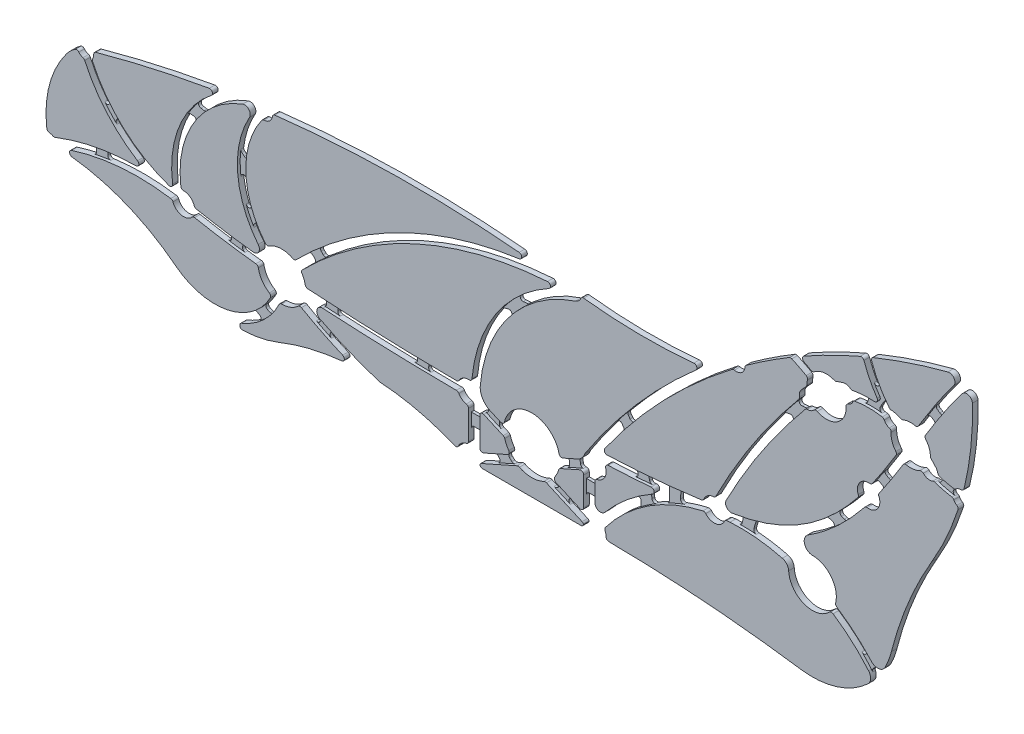
from build123d import *

# Parameters (mm, degrees)
EXTRUDE_1_DEPTH    = 2
EXTRUDE_1_2_DEPTH  = 2
EXTRUDE_1_3_DEPTH  = 2
EXTRUDE_1_4_DEPTH  = 2
EXTRUDE_1_5_DEPTH  = 2
EXTRUDE_1_6_DEPTH  = 2
EXTRUDE_1_7_DEPTH  = 2
EXTRUDE_1_8_DEPTH  = 2
EXTRUDE_1_9_DEPTH  = 2
EXTRUDE_1_10_DEPTH = 2
EXTRUDE_1_11_DEPTH = 2
EXTRUDE_1_12_DEPTH = 2
EXTRUDE_1_13_DEPTH = 2
EXTRUDE_1_14_DEPTH = 2
EXTRUDE_1_15_DEPTH = 2
EXTRUDE_1_16_DEPTH = 2
EXTRUDE_1_17_DEPTH = 2
EXTRUDE_1_18_DEPTH = 2
EXTRUDE_1_19_DEPTH = 2
EXTRUDE_1_20_DEPTH = 2
EXTRUDE_2_DEPTH    = 1


with BuildPart() as part:
    # ｽｹｯﾁ1 → ﾎﾞｽ - 押し出し1 (new body)
    with BuildSketch(Plane.XY):
        with BuildLine():
            Line((-22.5, -10.101020514), (-22.5, 0.101020514))
            ThreePointArc((-22.5, 0.101020514), (-22.725403331, 0.733476046), (-23.3, 1.080816412))
            ThreePointArc((-23.3, 1.080816412), (-24.842007836, 1.757316035), (-25.968976767, 3.008467879))
            ThreePointArc((-25.968976767, 3.008467879), (-26.333052589, 3.374773249), (-26.831338926, 3.510572931))
            ThreePointArc((-26.831338926, 3.510572931), (-50.650061214, 3.946700568), (-74.448487112, 5.022183474))
            ThreePointArc((-74.448487112, 5.022183474), (-76.493832753, 3.556551996), (-75.487010068, 1.250511558))
            ThreePointArc((-75.487010068, 1.250511558), (-65.082931287, -3.594550625), (-54.301384043, -7.528724215))
            ThreePointArc((-54.301384043, -7.528724215), (-54.184018837, -7.558239038), (-54.063947757, -7.573360277))
            ThreePointArc((-54.063947757, -7.573360277), (-40.48832194, -9.598088167), (-27.436621612, -13.846647678))
            ThreePointArc((-27.436621612, -13.846647678), (-26.685177052, -13.856277421), (-26.139219533, -13.339855069))
            ThreePointArc((-26.139219533, -13.339855069), (-24.990478153, -11.869901188), (-23.3, -11.080816412))
            ThreePointArc((-23.3, -11.080816412), (-22.725403331, -10.733476046), (-22.5, -10.101020514))
        make_face()
    extrude(amount=-EXTRUDE_1_DEPTH)



with BuildPart() as body_2:
    # ｽｹｯﾁ1 → Extrude 1 2 (new body)
    with BuildSketch(Plane.XY):
        with BuildLine():
            Line((22.5, 0.101020514), (22.5, -6.412581397))
            ThreePointArc((22.5, -6.412581397), (23.81401004, -8.291255869), (26.029417775, -7.701333223))
            ThreePointArc((26.029417775, -7.701333223), (33.93186129, 0.147888894), (43.093796505, 6.481753786))
            ThreePointArc((43.093796505, 6.481753786), (43.555392432, 7.64713656), (42.516080074, 8.347863062))
            ThreePointArc((42.516080074, 8.347863062), (34.893320679, 7.7891821), (27.260130447, 7.398040053))
            ThreePointArc((27.260130447, 7.398040053), (26.488503415, 6.982739341), (26.340268538, 6.119078888))
            ThreePointArc((26.340268538, 6.119078888), (25.924769368, 2.933371156), (23.3, 1.080816412))
            ThreePointArc((23.3, 1.080816412), (22.725403331, 0.733476046), (22.5, 0.101020514))
        make_face()
    extrude(amount=-EXTRUDE_1_2_DEPTH)


with BuildPart() as body_3:
    # ｽｹｯﾁ1 → Extrude 1 3 (new body)
    with BuildSketch(Plane.XY):
        with BuildLine():
            Line((18.5, -10.041983944), (18.5, 0.041983944))
            ThreePointArc((18.5, 0.041983944), (18.044913541, 0.880476182), (17.093861534, 0.955795493))
            Line((17.093861534, 0.955795493), (10.166331831, -2.123106598))
            ThreePointArc((10.166331831, -2.123106598), (9.818127838, -2.380437031), (9.611336633, -2.760834679))
            ThreePointArc((9.611336633, -2.760834679), (9.032200451, -4.291777604), (8.211074914, -5.70773587))
            ThreePointArc((8.211074914, -5.70773587), (8.06909808, -6.547709353), (8.626043939, -7.192321006))
            Line((8.626043939, -7.192321006), (17.093861534, -10.955795493))
            ThreePointArc((17.093861534, -10.955795493), (18.044913541, -10.880476182), (18.5, -10.041983944))
        make_face()
    extrude(amount=-EXTRUDE_1_3_DEPTH)


with BuildPart() as body_4:
    # ｽｹｯﾁ1 → Extrude 1 4 (new body)
    with BuildSketch(Plane.XY):
        with BuildLine():
            Line((-10.166331831, -2.123106598), (-17.093861534, 0.955795493))
            ThreePointArc((-17.093861534, 0.955795493), (-18.044913541, 0.880476182), (-18.5, 0.041983944))
            Line((-18.5, 0.041983944), (-18.5, -10.041983944))
            ThreePointArc((-18.5, -10.041983944), (-18.044913541, -10.880476182), (-17.093861534, -10.955795493))
            Line((-17.093861534, -10.955795493), (-8.626043939, -7.192321006))
            ThreePointArc((-8.626043939, -7.192321006), (-8.06909808, -6.547709353), (-8.211074914, -5.70773587))
            ThreePointArc((-8.211074914, -5.70773587), (-9.032200451, -4.291777604), (-9.611336633, -2.760834679))
            ThreePointArc((-9.611336633, -2.760834679), (-9.818127838, -2.380437031), (-10.166331831, -2.123106598))
        make_face()
    extrude(amount=-EXTRUDE_1_4_DEPTH)


with BuildPart() as body_5:
    # ｽｹｯﾁ1 → Extrude 1 5 (new body)
    with BuildSketch(Plane.XY):
        with BuildLine():
            Line((-17.5, -16), (17.5, -16))
            ThreePointArc((17.5, -16), (18.127636647, -15.778506416), (18.477238313, -15.212144479))
            ThreePointArc((18.477238313, -15.212144479), (18.268989106, -14.854674582), (17.933872224, -14.612086178))
            Line((17.933872224, -14.612086178), (5.236576226, -8.968843512))
            ThreePointArc((5.236576226, -8.968843512), (4.812235497, -8.882820735), (4.391307055, -8.984231873))
            ThreePointArc((4.391307055, -8.984231873), (0, -10), (-4.391307055, -8.984231873))
            ThreePointArc((-4.391307055, -8.984231873), (-4.812235497, -8.882820735), (-5.236576226, -8.968843512))
            Line((-5.236576226, -8.968843512), (-17.933872224, -14.612086178))
            ThreePointArc((-17.933872224, -14.612086178), (-18.268989106, -14.854674582), (-18.477238313, -15.212144479))
            ThreePointArc((-18.477238313, -15.212144479), (-18.127636647, -15.778506416), (-17.5, -16))
        make_face()
    extrude(amount=-EXTRUDE_1_5_DEPTH)


with BuildPart() as body_6:
    # ｽｹｯﾁ1 → Extrude 1 6 (new body)
    with BuildSketch(Plane.XY):
        with BuildLine():
            Line((11.118968747, 1.583240188), (16.202361285, 3.84252576))
            ThreePointArc((16.202361285, 3.84252576), (17.758858971, 4.928471706), (18.798519535, 6.516259335))
            ThreePointArc((18.798519535, 6.516259335), (18.959270279, 6.860976368), (19.152035998, 7.188866612))
            ThreePointArc((19.152035998, 7.188866612), (37.276714505, 31.160374537), (58.499178516, 52.438160712))
            ThreePointArc((58.499178516, 52.438160712), (58.759792741, 53.585885084), (57.747756386, 54.186695724))
            ThreePointArc((57.747756386, 54.186695724), (38.112812762, 53.374184357), (18.499758812, 54.606783477))
            ThreePointArc((18.499758812, 54.606783477), (17.871800431, 54.471525722), (17.45567904, 53.982169639))
            ThreePointArc((17.45567904, 53.982169639), (16.726416816, 52.906959729), (15.610951372, 52.240899233))
            ThreePointArc((15.610951372, 52.240899233), (-7.814521193, 35.812462193), (-18.322470408, 9.199884119))
            ThreePointArc((-18.322470408, 9.199884119), (-17.508416253, 5.639452419), (-14.780704116, 3.210678129))
            Line((-14.780704116, 3.210678129), (-11.118968747, 1.583240188))
            ThreePointArc((-11.118968747, 1.583240188), (-10.267282975, 1.601793339), (-9.738936619, 2.270047033))
            ThreePointArc((-9.738936619, 2.270047033), (0, 10), (9.738936619, 2.270047033))
            ThreePointArc((9.738936619, 2.270047033), (10.267282975, 1.601793339), (11.118968747, 1.583240188))
        make_face()
    extrude(amount=-EXTRUDE_1_6_DEPTH)


with BuildPart() as body_7:
    # ｽｹｯﾁ1 → Extrude 1 7 (new body)
    with BuildSketch(Plane.XY):
        with BuildLine():
            ThreePointArc((-103.356558634, -14.060718986), (-95.498956322, -9.057744291), (-89.967031901, -1.563114074))
            ThreePointArc((-89.967031901, -1.563114074), (-89.595121172, -1.150343934), (-89.060304278, -0.999786079))
            ThreePointArc((-89.060304278, -0.999786079), (-85.918070339, -0.421597665), (-83.211270872, 1.275804061))
            ThreePointArc((-83.211270872, 1.275804061), (-82.64364503, 1.537095003), (-82.031739222, 1.410432715))
            ThreePointArc((-82.031739222, 1.410432715), (-74.799057097, -2.464433401), (-67.34675765, -5.898019149))
            ThreePointArc((-67.34675765, -5.898019149), (-66.749100435, -6.968649503), (-67.637822736, -7.813407558))
            ThreePointArc((-67.637822736, -7.813407558), (-79.072499433, -9.782229594), (-90.117629525, -13.336549869))
            ThreePointArc((-90.117629525, -13.336549869), (-96.419112305, -15.235486438), (-102.957342201, -15.987945839))
            ThreePointArc((-102.957342201, -15.987945839), (-103.962078134, -15.191111022), (-103.356558634, -14.060718986))
        make_face()
    extrude(amount=-EXTRUDE_1_7_DEPTH)


with BuildPart() as body_8:
    # ｽｹｯﾁ1 → Extrude 1 8 (new body)
    with BuildSketch(Plane.XY):
        with BuildLine():
            ThreePointArc((-126.720890547, -8.125345919), (-144.171431804, 2.021447824), (-163.725732783, 7.032248826))
            ThreePointArc((-163.725732783, 7.032248826), (-164.608066794, 7.92635712), (-163.920291551, 8.977503239))
            ThreePointArc((-163.920291551, 8.977503239), (-146.403950854, 12.457005785), (-128.557163274, 11.807927609))
            ThreePointArc((-128.557163274, 11.807927609), (-128.07237572, 11.59059704), (-127.76731798, 11.155635749))
            ThreePointArc((-127.76731798, 11.155635749), (-124.75804267, 8.572485352), (-121.003592282, 9.850180989))
            ThreePointArc((-121.003592282, 9.850180989), (-120.575847385, 10.134684344), (-120.063293842, 10.169278015))
            ThreePointArc((-120.063293842, 10.169278015), (-109.189695688, 8.283956274), (-98.247377431, 6.850343342))
            ThreePointArc((-98.247377431, 6.850343342), (-97.672725088, 6.585818326), (-97.371810397, 6.029357053))
            ThreePointArc((-97.371810397, 6.029357053), (-96.028031748, 2.719124583), (-93.442710672, 0.253461386))
            ThreePointArc((-93.442710672, 0.253461386), (-93.00002742, -0.338132848), (-93.084381906, -1.072187697))
            ThreePointArc((-93.084381906, -1.072187697), (-108.261136719, -12.427077278), (-126.720890547, -8.125345919))
        make_face()
    extrude(amount=-EXTRUDE_1_8_DEPTH)


with BuildPart() as body_9:
    # ｽｹｯﾁ1 → Extrude 1 9 (new body)
    with BuildSketch(Plane.XY):
        with BuildLine():
            ThreePointArc((-114.850046871, 52.666941105), (-135.171119836, 48.606684839), (-155.268554706, 43.554477497))
            ThreePointArc((-155.268554706, 43.554477497), (-155.803951642, 43.187014896), (-156.000775173, 42.568194129))
            ThreePointArc((-156.000775173, 42.568194129), (-156.085215089, 41.790050054), (-156.368067103, 41.060232927))
            ThreePointArc((-156.368067103, 41.060232927), (-156.490114246, 40.616134725), (-156.400178828, 40.164437549))
            ThreePointArc((-156.400178828, 40.164437549), (-145.340870587, 25.04107642), (-129.217245632, 15.498903244))
            ThreePointArc((-129.217245632, 15.498903244), (-128.25649785, 15.67177038), (-127.900790598, 16.580831267))
            ThreePointArc((-127.900790598, 16.580831267), (-125.547381919, 35.580716416), (-114.059534107, 50.896183133))
            ThreePointArc((-114.059534107, 50.896183133), (-113.765093768, 52.089460809), (-114.850046871, 52.666941105))
        make_face()
    extrude(amount=-EXTRUDE_1_9_DEPTH)


with BuildPart() as body_10:
    # ｽｹｯﾁ1 → Extrude 1 10 (new body)
    with BuildSketch(Plane.XY):
        with BuildLine():
            ThreePointArc((-140.92626069, 15.699704338), (-155.581300438, 14.221758305), (-169.717010958, 10.08216864))
            ThreePointArc((-169.717010958, 10.08216864), (-170.14622041, 10.013780427), (-170.563904339, 10.133937974))
            ThreePointArc((-170.563904339, 10.133937974), (-171.155696028, 10.378741184), (-171.785964151, 10.492355035))
            ThreePointArc((-171.785964151, 10.492355035), (-172.401803697, 10.763324084), (-172.706566648, 11.363159157))
            ThreePointArc((-172.706566648, 11.363159157), (-171.77520359, 25.346722117), (-165.635293674, 37.944697209))
            ThreePointArc((-165.635293674, 37.944697209), (-164.259804057, 39.486741818), (-162.652608619, 40.785508959))
            ThreePointArc((-162.652608619, 40.785508959), (-161.947741849, 40.949117243), (-161.317043281, 40.594400243))
            ThreePointArc((-161.317043281, 40.594400243), (-160.648344956, 39.993416886), (-159.831599898, 39.617563251))
            ThreePointArc((-159.831599898, 39.617563251), (-159.454634512, 39.413102568), (-159.197974761, 39.069543482))
            ThreePointArc((-159.197974761, 39.069543482), (-151.384643178, 26.924630489), (-140.402865662, 17.546591002))
            ThreePointArc((-140.402865662, 17.546591002), (-139.972472291, 16.427013854), (-140.92626069, 15.699704338))
        make_face()
    extrude(amount=-EXTRUDE_1_10_DEPTH)


with BuildPart() as body_11:
    # ｽｹｯﾁ1 → Extrude 1 11 (new body)
    with BuildSketch(Plane.XY):
        with BuildLine():
            ThreePointArc((-4.470999079, 57.250282757), (-48.007817114, 58.908356302), (-91.48378022, 56.07209741))
            ThreePointArc((-91.48378022, 56.07209741), (-92.069225942, 55.791149679), (-92.358682449, 55.209863819))
            ThreePointArc((-92.358682449, 55.209863819), (-93.350087626, 53.351369569), (-95.318967313, 52.602772294))
            ThreePointArc((-95.318967313, 52.602772294), (-95.774491653, 52.49062391), (-96.128746209, 52.183079777))
            ThreePointArc((-96.128746209, 52.183079777), (-101.822459182, 33.316779439), (-94.900870104, 14.865566457))
            ThreePointArc((-94.900870104, 14.865566457), (-94.283684874, 14.510594718), (-93.586754605, 14.6562338))
            ThreePointArc((-93.586754605, 14.6562338), (-89.394333262, 15.990848089), (-85.096260122, 15.05055064))
            ThreePointArc((-85.096260122, 15.05055064), (-84.479111763, 14.951393184), (-83.923649691, 15.238039629))
            ThreePointArc((-83.923649691, 15.238039629), (-47.483352354, 41.826061968), (-4.422429146, 55.263885244))
            ThreePointArc((-4.422429146, 55.263885244), (-3.560849299, 56.278744516), (-4.470999079, 57.250282757))
        make_face()
    extrude(amount=-EXTRUDE_1_11_DEPTH)


with BuildPart() as body_12:
    # ｽｹｯﾁ1 → Extrude 1 12 (new body)
    with BuildSketch(Plane.XY):
        with BuildLine():
            ThreePointArc((-22.314015361, 8.995673875), (-24.414609558, 8.512017973), (-25.959198864, 7.008467879))
            ThreePointArc((-25.959198864, 7.008467879), (-26.327181142, 6.642729772), (-26.828894412, 6.510596833))
            ThreePointArc((-26.828894412, 6.510596833), (-53.301872163, 7.036667802), (-79.74722804, 8.355172349))
            ThreePointArc((-79.74722804, 8.355172349), (-80.341592557, 8.601026945), (-80.663274603, 9.158013769))
            ThreePointArc((-80.663274603, 9.158013769), (-81.101716083, 10.641195817), (-81.801654702, 12.020378853))
            ThreePointArc((-81.801654702, 12.020378853), (-81.94890883, 12.660487916), (-81.667277078, 13.253873919))
            ThreePointArc((-81.667277078, 13.253873919), (-41.702064453, 41.277821121), (5.609573539, 53.284850211))
            ThreePointArc((5.609573539, 53.284850211), (6.637189872, 52.564938691), (6.152522338, 51.407629179))
            ThreePointArc((6.152522338, 51.407629179), (-12.757832942, 34.089272661), (-21.271842987, 9.901700598))
            ThreePointArc((-21.271842987, 9.901700598), (-21.611427135, 9.239911484), (-22.314015361, 8.995673875))
        make_face()
    extrude(amount=-EXTRUDE_1_12_DEPTH)


with BuildPart() as body_13:
    # ｽｹｯﾁ1 → Extrude 1 13 (new body)
    with BuildSketch(Plane.XY):
        with BuildLine():
            ThreePointArc((-100.505114473, 50.878987248), (-104.726719606, 31.575944409), (-97.424637255, 13.215415929))
            ThreePointArc((-97.424637255, 13.215415929), (-97.235079465, 10.997428592), (-99.214022424, 9.978024479))
            ThreePointArc((-99.214022424, 9.978024479), (-109.36232121, 11.345501175), (-119.449838366, 13.106171051))
            ThreePointArc((-119.449838366, 13.106171051), (-119.918131969, 13.335906367), (-120.207034495, 13.770201826))
            ThreePointArc((-120.207034495, 13.770201826), (-121.659362935, 15.743673555), (-123.98999328, 16.499987483))
            ThreePointArc((-123.98999328, 16.499987483), (-124.649769443, 16.750726015), (-124.979615741, 17.374725869))
            ThreePointArc((-124.979615741, 17.374725869), (-120.295248245, 39.392547584), (-102.944576602, 53.73416414))
            ThreePointArc((-102.944576602, 53.73416414), (-100.727848949, 53.158409228), (-100.505114473, 50.878987248))
        make_face()
    extrude(amount=-EXTRUDE_1_13_DEPTH)


with BuildPart() as body_14:
    # ｽｹｯﾁ1 → Extrude 1 14 (new body)
    with BuildSketch(Plane.XY):
        with BuildLine():
            ThreePointArc((107.745169421, 73.920489866), (104.035554327, 74.414473762), (100.601598753, 72.926786512))
            ThreePointArc((100.601598753, 72.926786512), (100.053312977, 72.707932638), (99.477126101, 72.836474436))
            ThreePointArc((99.477126101, 72.836474436), (98.233931235, 73.530059693), (96.976789503, 74.198033231))
            ThreePointArc((96.976789503, 74.198033231), (96.437083464, 75.068877577), (96.946878275, 75.957562975))
            ThreePointArc((96.946878275, 75.957562975), (106.841656639, 81.189233057), (116.993029265, 85.9037473))
            ThreePointArc((116.993029265, 85.9037473), (117.791441284, 85.902420306), (118.334402634, 85.317051632))
            ThreePointArc((118.334402634, 85.317051632), (120.363163566, 80.53748433), (122.987570022, 76.057235981))
            ThreePointArc((122.987570022, 76.057235981), (123.025245698, 74.997944172), (122.089604161, 74.499854314))
            ThreePointArc((122.089604161, 74.499854314), (118.195023505, 74.518282292), (114.330580957, 74.03435888))
            ThreePointArc((114.330580957, 74.03435888), (113.911582503, 74.043529717), (113.533139444, 74.223598206))
            ThreePointArc((113.533139444, 74.223598206), (112.244264312, 74.796025008), (110.836246698, 74.71628826))
            ThreePointArc((110.836246698, 74.71628826), (109.660624664, 74.335336357), (108.50077585, 73.908766026))
            ThreePointArc((108.50077585, 73.908766026), (108.121822546, 73.840504228), (107.745169421, 73.920489866))
        make_face()
    extrude(amount=-EXTRUDE_1_14_DEPTH)


with BuildPart() as body_15:
    # ｽｹｯﾁ1 → Extrude 1 15 (new body)
    with BuildSketch(Plane.XY):
        with BuildLine():
            ThreePointArc((89.273595206, 9.756792154), (80.049706865, 11.400344352), (70.682393404, 11.586941397))
            ThreePointArc((70.682393404, 11.586941397), (70.643120282, 11.583872322), (70.603998507, 11.579258847))
            ThreePointArc((70.603998507, 11.579258847), (70.017526668, 11.500504899), (69.430506154, 11.425950762))
            ThreePointArc((69.430506154, 11.425950762), (68.960800584, 11.239294826), (68.642371358, 10.846781657))
            ThreePointArc((68.642371358, 10.846781657), (65.564057635, 8.539969825), (61.964082393, 9.895541461))
            ThreePointArc((61.964082393, 9.895541461), (61.519642672, 10.193671151), (60.985116277, 10.219929694))
            ThreePointArc((60.985116277, 10.219929694), (41.602155025, 2.06939678), (26.224992097, -12.271915363))
            ThreePointArc((26.224992097, -12.271915363), (26.029919562, -12.770267331), (26.119760126, -13.297843535))
            ThreePointArc((26.119760126, -13.297843535), (26.405864749, -14.137317809), (26.499953909, -15.019202234))
            ThreePointArc((26.499953909, -15.019202234), (26.787762201, -15.725999505), (27.49034138, -16.023956702))
            ThreePointArc((27.49034138, -16.023956702), (61.783072383, -17.486582136), (95.904497639, -21.209351445))
            ThreePointArc((95.904497639, -21.209351445), (108.674407076, -20.172272438), (119.751248422, -13.734127855))
            ThreePointArc((119.751248422, -13.734127855), (120.70255746, -11.718381768), (120.000805926, -9.602781154))
            ThreePointArc((120.000805926, -9.602781154), (114.070402793, -3.50960152), (107.337748418, 1.683459661))
            ThreePointArc((107.337748418, 1.683459661), (106.680167747, 1.84485003), (106.070500124, 1.550291751))
            ThreePointArc((106.070500124, 1.550291751), (97.009254914, -0.45647182), (91.513444146, 7.022119544))
            ThreePointArc((91.513444146, 7.022119544), (90.839066816, 8.754383733), (89.273595206, 9.756792154))
        make_face()
    extrude(amount=-EXTRUDE_1_15_DEPTH)


with BuildPart() as body_16:
    # ｽｹｯﾁ1 → Extrude 1 16 (new body)
    with BuildSketch(Plane.XY):
        with BuildLine():
            ThreePointArc((71.343129401, 59.077169187), (46.898048291, 37.235706645), (26.021967296, 11.961199356))
            ThreePointArc((26.021967296, 11.961199356), (25.960207207, 10.906984019), (26.878319095, 10.385203561))
            ThreePointArc((26.878319095, 10.385203561), (43.722386211, 11.463371837), (60.493566976, 13.364040033))
            ThreePointArc((60.493566976, 13.364040033), (60.972999003, 13.567125642), (61.285349547, 13.983702131))
            ThreePointArc((61.285349547, 13.983702131), (62.655797065, 15.741097437), (64.753909299, 16.492422744))
            ThreePointArc((64.753909299, 16.492422744), (65.240913382, 16.654395429), (65.583431059, 17.036612343))
            ThreePointArc((65.583431059, 17.036612343), (79.093035157, 40.212538503), (95.134397943, 61.713878839))
            ThreePointArc((95.134397943, 61.713878839), (95.336157636, 62.105899259), (95.349720401, 62.546583993))
            ThreePointArc((95.349720401, 62.546583993), (95.395423067, 63.8877696), (96.021295968, 65.074846127))
            ThreePointArc((96.021295968, 65.074846127), (96.845691965, 65.995488705), (97.705410986, 66.8832357))
            ThreePointArc((97.705410986, 66.8832357), (97.921285564, 67.202082756), (98.000680849, 67.578860765))
            ThreePointArc((98.000680849, 67.578860765), (98.063053837, 68.418663332), (98.225822663, 69.244898802))
            ThreePointArc((98.225822663, 69.244898802), (98.178932991, 69.886768371), (97.750631704, 70.36713614))
            ThreePointArc((97.750631704, 70.36713614), (95.226633677, 71.724656509), (92.646482628, 72.972153264))
            ThreePointArc((92.646482628, 72.972153264), (92.1751128, 73.061144555), (91.716533423, 72.920382631))
            ThreePointArc((91.716533423, 72.920382631), (83.925565639, 68.022389418), (76.349274765, 62.798470094))
            ThreePointArc((76.349274765, 62.798470094), (76.054051204, 62.462018089), (75.935182614, 62.030477638))
            ThreePointArc((75.935182614, 62.030477638), (74.72769572, 59.751974852), (72.197875937, 59.252363596))
            ThreePointArc((72.197875937, 59.252363596), (71.750387624, 59.262904595), (71.343129401, 59.077169187))
        make_face()
    extrude(amount=-EXTRUDE_1_16_DEPTH)


with BuildPart() as body_17:
    # ｽｹｯﾁ1 → Extrude 1 17 (new body)
    with BuildSketch(Plane.XY):
        with BuildLine():
            ThreePointArc((69.257723432, 17.617675978), (69.404595356, 15.529642509), (71.333254774, 14.716175865))
            add(Edge.make_bspline(
                [(71.333254774, 14.716175865), (71.614504166, 14.759136638), (73.409438449, 15.043486715), (76.620780353, 15.671863381), (80.797913885, 16.762501548), (86.082324681, 18.506149632), (92.181209568, 21.200378892), (98.790819511, 25.172870999), (104.787291443, 29.804254012), (110.605870721, 35.341540936), (114.252250774, 39.538319712), (116.153912199, 41.910100809)],
                knots=[0.541498181, 0.541498181, 0.541498181, 0.541498181, 0.547174934, 0.577902268, 0.608629602, 0.639356936, 0.700811604, 0.762266273, 0.823720941, 0.885175609, 0.958224109, 0.958224109, 0.958224109, 0.958224109], degree=3))
            ThreePointArc((116.153912199, 41.910100809), (116.363463713, 42.392765504), (116.298978924, 42.914990318))
            ThreePointArc((116.298978924, 42.914990318), (116.797403013, 46.828904068), (120.411783315, 48.411118481))
            ThreePointArc((120.411783315, 48.411118481), (120.929284322, 48.495781267), (121.332792985, 48.830678024))
            add(Edge.make_bspline(
                [(121.332792985, 48.830678024), (123.860286294, 52.425795928), (126.654423832, 56.750949776), (129.38878449, 61.166659042), (129.760514936, 61.769694758)],
                knots=[0.352317169, 0.352317169, 0.352317169, 0.352317169, 0.456353113, 0.472763953, 0.472763953, 0.472763953, 0.472763953], degree=3))
            ThreePointArc((129.760514936, 61.769694758), (129.906330096, 62.370863984), (129.67059794, 62.942787797))
            ThreePointArc((129.67059794, 62.942787797), (128.348605081, 65.299730994), (128.017920694, 67.981800007))
            ThreePointArc((128.017920694, 67.981800007), (127.852816871, 68.607581037), (127.339079784, 69.00119935))
            ThreePointArc((127.339079784, 69.00119935), (126.29654459, 69.60730952), (125.576906384, 70.574971663))
            ThreePointArc((125.576906384, 70.574971663), (125.281409422, 70.943694366), (124.849604668, 71.135578553))
            ThreePointArc((124.849604668, 71.135578553), (120, 71.572377608), (115.150395332, 71.135578553))
            ThreePointArc((115.150395332, 71.135578553), (114.718590578, 70.943694366), (114.423093616, 70.574971663))
            ThreePointArc((114.423093616, 70.574971663), (113.70345541, 69.60730952), (112.660920216, 69.00119935))
            ThreePointArc((112.660920216, 69.00119935), (112.147183129, 68.607581037), (111.982079306, 67.981800007))
            ThreePointArc((111.982079306, 67.981800007), (108.818181818, 61.614248932), (101.714859342, 61.299981825))
            ThreePointArc((101.714859342, 61.299981825), (101.075825626, 61.402437082), (100.50788434, 61.092108441))
            ThreePointArc((100.50788434, 61.092108441), (99.463987015, 60.354774164), (98.207911317, 60.118856168))
            ThreePointArc((98.207911317, 60.118856168), (97.769172649, 60.031474199), (97.41243615, 59.761536619))
            ThreePointArc((97.41243615, 59.761536619), (82.191064591, 39.453879405), (69.257723432, 17.617675978))
        make_face()
    extrude(amount=-EXTRUDE_1_17_DEPTH)


with BuildPart() as body_18:
    # ｽｹｯﾁ1 → Extrude 1 18 (new body)
    with BuildSketch(Plane.XY):
        with BuildLine():
            ThreePointArc((148.233146487, 96.700551949), (134.790692615, 92.706125691), (121.634308586, 87.851790875))
            ThreePointArc((121.634308586, 87.851790875), (121.100824658, 87.340386295), (121.064206489, 86.602281387))
            ThreePointArc((121.064206489, 86.602281387), (123.702181112, 80.633649045), (127.336357893, 75.213663689))
            ThreePointArc((127.336357893, 75.213663689), (127.703850215, 74.929373539), (128.160150137, 74.841841395))
            ThreePointArc((128.160150137, 74.841841395), (128.667281007, 74.821664241), (129.163753302, 74.71628826))
            ThreePointArc((129.163753302, 74.71628826), (130.339375336, 74.335336357), (131.49922415, 73.908766026))
            ThreePointArc((131.49922415, 73.908766026), (131.878177454, 73.840504228), (132.254830579, 73.920489866))
            ThreePointArc((132.254830579, 73.920489866), (134.392874909, 74.454853433), (136.591096214, 74.298006141))
            ThreePointArc((136.591096214, 74.298006141), (137.203180916, 74.348824921), (137.670112992, 74.747829517))
            add(Edge.make_bspline(
                [(137.670112992, 74.747829517), (140.240473974, 78.92571989), (144.300186764, 85.33672362), (148.708850772, 91.442758638), (150.326318977, 93.547208301)],
                knots=[0.06143114, 0.06143114, 0.06143114, 0.06143114, 0.174105437, 0.235583634, 0.235583634, 0.235583634, 0.235583634], degree=3))
            ThreePointArc((150.326318977, 93.547208301), (150.406889536, 95.872080726), (148.233146487, 96.700551949))
        make_face()
    extrude(amount=-EXTRUDE_1_18_DEPTH)


with BuildPart() as body_19:
    # ｽｹｯﾁ1 → Extrude 1 19 (new body)
    with BuildSketch(Plane.XY):
        with BuildLine():
            ThreePointArc((153.974336047, 63.496711978), (156.407303766, 77.356990536), (156.95871287, 91.41837744))
            ThreePointArc((156.95871287, 91.41837744), (155.584650657, 93.261989436), (153.38430558, 92.594581239))
            add(Edge.make_bspline(
                [(153.38430558, 92.594581239), (153.104495244, 92.236934413), (151.189593008, 89.761627373), (146.657650725, 83.453304938), (142.696287318, 77.192352385), (140.236781197, 73.194666812)],
                knots=[0.052703532, 0.052703532, 0.052703532, 0.052703532, 0.063492248, 0.126984497, 0.235410038, 0.235410038, 0.235410038, 0.235410038], degree=3))
            ThreePointArc((140.236781197, 73.194666812), (140.091472024, 72.593588521), (140.327435168, 72.021984408))
            ThreePointArc((140.327435168, 72.021984408), (141.551530732, 69.946479233), (141.999319151, 67.578860765))
            ThreePointArc((141.999319151, 67.578860765), (142.078714436, 67.202082756), (142.294589014, 66.8832357))
            ThreePointArc((142.294589014, 66.8832357), (143.154308035, 65.995488705), (143.978704032, 65.074846127))
            ThreePointArc((143.978704032, 65.074846127), (144.399069128, 64.437692205), (144.645024595, 63.715073466))
            ThreePointArc((144.645024595, 63.715073466), (144.882580356, 63.24428851), (145.326579343, 62.959795782))
            ThreePointArc((145.326579343, 62.959795782), (147.74564025, 62.291578487), (150.204030248, 61.786911622))
            ThreePointArc((150.204030248, 61.786911622), (150.638732608, 61.80885322), (151.022937008, 62.013388192))
            ThreePointArc((151.022937008, 62.013388192), (151.944301544, 62.552841011), (152.996239059, 62.735459239))
            ThreePointArc((152.996239059, 62.735459239), (153.617445554, 62.946282157), (153.974336047, 63.496711978))
        make_face()
    extrude(amount=-EXTRUDE_1_19_DEPTH)


with BuildPart() as body_20:
    # ｽｹｯﾁ1 → Extrude 1 20 (new body)
    with BuildSketch(Plane.XY):
        with BuildLine():
            ThreePointArc((143.571046826, 60.376062231), (146.562441547, 59.49371431), (149.612934356, 58.844504131))
            ThreePointArc((149.612934356, 58.844504131), (150.029216938, 58.669006172), (150.325785264, 58.328215988))
            ThreePointArc((150.325785264, 58.328215988), (150.789990268, 57.680099045), (151.40850633, 57.177128133))
            ThreePointArc((151.40850633, 57.177128133), (151.824628715, 56.66999307), (151.836934791, 56.014102551))
            ThreePointArc((151.836934791, 56.014102551), (147.745407286, 45.4518558), (142.536293001, 35.39368588))
            ThreePointArc((142.536293001, 35.39368588), (134.07925039, 18.380808166), (128.103750797, 0.346036683))
            ThreePointArc((128.103750797, 0.346036683), (127.166359581, -2.648345044), (125.910949972, -5.523926887))
            ThreePointArc((125.910949972, -5.523926887), (123.628983467, -7.150042408), (120.99938497, -6.182140264))
            ThreePointArc((120.99938497, -6.182140264), (115.180555638, -0.495167069), (108.676920035, 4.393919026))
            ThreePointArc((108.676920035, 4.393919026), (108.294327864, 4.864318046), (108.253865555, 5.469309624))
            ThreePointArc((108.253865555, 5.469309624), (106.702187254, 12.72787586), (100.0397327, 15.999907136))
            ThreePointArc((100.0397327, 15.999907136), (97.170625427, 18.170683147), (98.448115048, 21.534024536))
            add(Edge.make_bspline(
                [(118.549804324, 40.102350396), (116.038558432, 36.965392293), (111.587113707, 31.947718613), (104.759265589, 25.876093342), (100.538792211, 22.858680396), (98.448115048, 21.534024536)],
                knots=[0.54080668, 0.54080668, 0.54080668, 0.54080668, 0.634922483, 0.698414731, 0.755202759, 0.755202759, 0.755202759, 0.755202759], degree=3))
            ThreePointArc((118.549804324, 40.102350396), (118.958889754, 40.405801694), (119.464375375, 40.468394558))
            ThreePointArc((119.464375375, 40.468394558), (123.202688843, 42.03595994), (123.651791065, 46.064676361))
            ThreePointArc((123.651791065, 46.064676361), (123.569384023, 46.569027429), (123.746924759, 47.048235325))
            add(Edge.make_bspline(
                [(132.32709633, 60.216119374), (131.67046671, 59.15087034), (128.895331228, 54.684284987), (126.032249103, 50.295893269), (123.746924759, 47.048235325)],
                knots=[0.352132248, 0.352132248, 0.352132248, 0.352132248, 0.38095349, 0.473304271, 0.473304271, 0.473304271, 0.473304271], degree=3))
            ThreePointArc((132.32709633, 60.216119374), (132.7941666, 60.614639845), (133.406069368, 60.665119596))
            ThreePointArc((133.406069368, 60.665119596), (135.903222204, 60.539748523), (138.285140658, 61.299981825))
            ThreePointArc((138.285140658, 61.299981825), (138.924174374, 61.402437082), (139.49211566, 61.092108441))
            ThreePointArc((139.49211566, 61.092108441), (141.061105651, 60.187537156), (142.864802758, 60.35080242))
            ThreePointArc((142.864802758, 60.35080242), (143.215619048, 60.427899087), (143.571046826, 60.376062231))
        make_face()
    extrude(amount=-EXTRUDE_1_20_DEPTH)


with BuildPart() as part_1:
    add(part.part)

    add(body_2.part)  # ﾎﾞｽ - 押し出し2 merges body 2

    add(body_3.part)  # ﾎﾞｽ - 押し出し2 merges body 3

    add(body_4.part)  # ﾎﾞｽ - 押し出し2 merges body 4

    add(body_5.part)  # ﾎﾞｽ - 押し出し2 merges body 5

    add(body_6.part)  # ﾎﾞｽ - 押し出し2 merges body 6

    add(body_7.part)  # ﾎﾞｽ - 押し出し2 merges body 7

    add(body_8.part)  # ﾎﾞｽ - 押し出し2 merges body 8

    add(body_9.part)  # ﾎﾞｽ - 押し出し2 merges body 9

    add(body_10.part)  # ﾎﾞｽ - 押し出し2 merges body 10

    add(body_11.part)  # ﾎﾞｽ - 押し出し2 merges body 11

    add(body_12.part)  # ﾎﾞｽ - 押し出し2 merges body 12

    add(body_13.part)  # ﾎﾞｽ - 押し出し2 merges body 13

    add(body_14.part)  # ﾎﾞｽ - 押し出し2 merges body 14

    add(body_15.part)  # ﾎﾞｽ - 押し出し2 merges body 15

    add(body_16.part)  # ﾎﾞｽ - 押し出し2 merges body 16

    add(body_17.part)  # ﾎﾞｽ - 押し出し2 merges body 17

    add(body_18.part)  # ﾎﾞｽ - 押し出し2 merges body 18

    add(body_19.part)  # ﾎﾞｽ - 押し出し2 merges body 19

    add(body_20.part)  # ﾎﾞｽ - 押し出し2 merges body 20
    # ｽｹｯﾁ2 → ﾎﾞｽ - 押し出し2 (add)
    with BuildSketch(Plane(origin=(0, 0, -2), x_dir=(-1, 0, 0), z_dir=(0, 0, -1))):
        with BuildLine():
            Line((22.5, -1.5), (18.5, -1.5))
            Line((18.5, -1.5), (18.5, -6.5))
            ThreePointArc((18.5, -6.5), (18.792893219, -5.792893219), (19.5, -5.5))
            Line((19.5, -5.5), (21.5, -5.5))
            ThreePointArc((21.5, -5.5), (22.207106781, -5.792893219), (22.5, -6.5))
            Line((22.5, -6.5), (22.5, -1.5))
        make_face()
        with BuildLine():
            ThreePointArc((12.490856196, -0.478028756), (12.319505304, -1.000636204), (11.897726166, -1.353598004))
            Line((11.897726166, -1.353598004), (17.093861534, 0.955795493))
            ThreePointArc((17.093861534, 0.955795493), (17.263355075, 1.013580146), (17.440437139, 1.040208501))
            ThreePointArc((17.440437139, 1.040208501), (16.738781017, 1.271806523), (16.387681462, 1.921951168))
            ThreePointArc((16.387681462, 1.921951168), (16.235512399, 2.942471264), (16.019855375, 3.951485008))
            ThreePointArc((16.019855375, 3.951485008), (15.422642383, 3.543675476), (14.780704116, 3.210678129))
            Line((14.780704116, 3.210678129), (11.118968747, 1.583240188))
            ThreePointArc((11.118968747, 1.583240188), (11.108113766, 1.578492557), (11.097203299, 1.573873865))
            ThreePointArc((11.097203299, 1.573873865), (12.012616466, 1.498042652), (12.479974258, 0.707278253))
            ThreePointArc((12.479974258, 0.707278253), (12.499473251, 0.114753811), (12.490856196, -0.478028756))
        make_face()
        with BuildLine():
            ThreePointArc((13.106472093, -10.023491871), (13.653553714, -9.662024511), (14.306942201, -9.717164678))
            Line((14.306942201, -9.717164678), (8.626043939, -7.192321006))
            ThreePointArc((8.626043939, -7.192321006), (8.615245968, -7.187445103), (8.604506523, -7.182441612))
            ThreePointArc((8.604506523, -7.182441612), (9.161640631, -7.91273828), (8.887859391, -8.789536702))
            ThreePointArc((8.887859391, -8.789536702), (8.46111377, -9.201062643), (8.0153359, -9.59189191))
            ThreePointArc((8.0153359, -9.59189191), (7.512598331, -9.814904487), (6.967970562, -9.738352106))
            Line((6.967970562, -9.738352106), (12.841251602, -12.348699234))
            ThreePointArc((12.841251602, -12.348699234), (12.271544543, -11.653349379), (12.49039635, -10.781465532))
            ThreePointArc((12.49039635, -10.781465532), (12.804044265, -10.407038506), (13.106472093, -10.023491871))
        make_face()
        with BuildLine():
            ThreePointArc((-8.604506523, -7.182441612), (-8.615245968, -7.187445103), (-8.626043939, -7.192321006))
            Line((-8.626043939, -7.192321006), (-14.306942201, -9.717164678))
            ThreePointArc((-14.306942201, -9.717164678), (-13.653553714, -9.662024511), (-13.106472093, -10.023491871))
            ThreePointArc((-13.106472093, -10.023491871), (-12.804044265, -10.407038506), (-12.49039635, -10.781465532))
            ThreePointArc((-12.49039635, -10.781465532), (-12.271544543, -11.653349379), (-12.841251602, -12.348699234))
            Line((-12.841251602, -12.348699234), (-6.967970562, -9.738352106))
            ThreePointArc((-6.967970562, -9.738352106), (-7.512598331, -9.814904487), (-8.0153359, -9.59189191))
            ThreePointArc((-8.0153359, -9.59189191), (-8.46111377, -9.201062643), (-8.887859391, -8.789536702))
            ThreePointArc((-8.887859391, -8.789536702), (-9.161640631, -7.91273828), (-8.604506523, -7.182441612))
        make_face()
        with BuildLine():
            ThreePointArc((-11.097203299, 1.573873865), (-11.108113766, 1.578492557), (-11.118968747, 1.583240188))
            Line((-11.118968747, 1.583240188), (-16.202361285, 3.84252576))
            ThreePointArc((-16.202361285, 3.84252576), (-16.451925774, 3.961816224), (-16.694511523, 4.094725227))
            ThreePointArc((-16.694511523, 4.094725227), (-16.289323816, 3.646496462), (-16.216275463, 3.046704796))
            ThreePointArc((-16.216275463, 3.046704796), (-16.311675863, 2.485805811), (-16.387681462, 1.921951168))
            ThreePointArc((-16.387681462, 1.921951168), (-16.738781017, 1.271806523), (-17.440437139, 1.040208501))
            ThreePointArc((-17.440437139, 1.040208501), (-17.263355075, 1.013580146), (-17.093861534, 0.955795493))
            Line((-17.093861534, 0.955795493), (-11.897726166, -1.353598004))
            ThreePointArc((-11.897726166, -1.353598004), (-12.319505304, -1.000636204), (-12.490856196, -0.478028756))
            ThreePointArc((-12.490856196, -0.478028756), (-12.499473251, 0.114753811), (-12.479974258, 0.707278253))
            ThreePointArc((-12.479974258, 0.707278253), (-12.012616466, 1.498042652), (-11.097203299, 1.573873865))
        make_face()
        with BuildLine():
            Line((-18.5, -6.5), (-18.5, -1.5))
            Line((-18.5, -1.5), (-22.5, -1.5))
            Line((-22.5, -1.5), (-22.5, -6.412581397))
            ThreePointArc((-22.5, -6.412581397), (-22.500212334, -6.441724025), (-22.500849293, -6.470860466))
            ThreePointArc((-22.500849293, -6.470860466), (-22.198002174, -5.782664815), (-21.501273939, -5.5))
            Line((-21.501273939, -5.5), (-19.5, -5.5))
            ThreePointArc((-19.5, -5.5), (-18.792893219, -5.792893219), (-18.5, -6.5))
        make_face()
        with BuildLine():
            ThreePointArc((150.858446398, 11.969671117), (153.82946059, 11.497507429), (156.779764834, 10.909656474))
            ThreePointArc((156.779764834, 10.909656474), (156.20922935, 11.266960646), (155.994467299, 11.904968697))
            ThreePointArc((155.994467299, 11.904968697), (155.999846483, 12.400878415), (155.997539597, 12.896811942))
            ThreePointArc((155.997539597, 12.896811942), (156.364896119, 13.683718292), (157.209316915, 13.886513598))
            ThreePointArc((157.209316915, 13.886513598), (154.162693842, 14.485294386), (151.095130915, 14.965407157))
            ThreePointArc((151.095130915, 14.965407157), (151.694927501, 14.652442038), (151.958208777, 14.029235747))
            ThreePointArc((151.958208777, 14.029235747), (151.982015668, 13.503393824), (151.995933325, 12.977197288))
            ThreePointArc((151.995933325, 12.977197288), (151.65912773, 12.211578678), (150.858446398, 11.969671117))
        make_face()
        with BuildLine():
            ThreePointArc((148.913948823, 25.278699232), (149.01122454, 24.661963323), (148.723719011, 24.107737451))
            ThreePointArc((148.723719011, 24.107737451), (150.962408797, 26.447341184), (153.04359446, 28.928095872))
            ThreePointArc((153.04359446, 28.928095872), (152.195655441, 28.54732407), (151.400636428, 29.028917792))
            ThreePointArc((151.400636428, 29.028917792), (151.130442273, 29.468768432), (150.853188017, 29.904203323))
            ThreePointArc((150.853188017, 29.904203323), (150.69320525, 30.489430563), (150.900993138, 31.059438986))
            ThreePointArc((150.900993138, 31.059438986), (148.940155736, 28.687563536), (146.826969906, 26.450350513))
            ThreePointArc((146.826969906, 26.450350513), (147.669125591, 26.730435654), (148.402372284, 26.230412482))
            ThreePointArc((148.402372284, 26.230412482), (148.6627517, 25.757023746), (148.913948823, 25.278699232))
        make_face()
        with BuildLine():
            ThreePointArc((116.774925757, 44.200173474), (118.815847622, 41.630705332), (120.601229885, 38.877536474))
            ThreePointArc((120.601229885, 38.877536474), (120.575962486, 39.837861552), (121.371506529, 40.376352381))
            ThreePointArc((121.371506529, 40.376352381), (121.944563883, 40.424454916), (122.518488266, 40.460778297))
            ThreePointArc((122.518488266, 40.460778297), (123.052558563, 40.338812324), (123.442229733, 39.953762768))
            ThreePointArc((123.442229733, 39.953762768), (121.572847408, 42.92803296), (119.431335506, 45.712777154))
            ThreePointArc((119.431335506, 45.712777154), (119.606670771, 44.720844822), (118.829853094, 44.079575377))
            ThreePointArc((118.829853094, 44.079575377), (118.275735254, 43.983849719), (117.723385059, 43.878401885))
            ThreePointArc((117.723385059, 43.878401885), (117.205968765, 43.911990011), (116.774925757, 44.200173474))
        make_face()
        with BuildLine():
            ThreePointArc((102.815666551, 30.809123855), (103.980207998, 31.068227221), (104.564106202, 30.027864676))
            ThreePointArc((104.564106202, 30.027864676), (104.839077249, 34.288631386), (104.574193541, 38.550037098))
            ThreePointArc((104.574193541, 38.550037098), (104.507263793, 38.045605407), (104.200764607, 37.639416816))
            ThreePointArc((104.200764607, 37.639416816), (103.751650905, 37.279111343), (103.309092669, 36.910783556))
            ThreePointArc((103.309092669, 36.910783556), (102.290560918, 36.745364129), (101.668060867, 37.56832476))
            ThreePointArc((101.668060867, 37.56832476), (101.816754131, 33.156157125), (101.332475519, 28.76812714))
            ThreePointArc((101.332475519, 28.76812714), (101.398892716, 28.986022313), (101.512898689, 29.183233338))
            ThreePointArc((101.512898689, 29.183233338), (102.149154856, 30.008299932), (102.815666551, 30.809123855))
        make_face()
        with BuildLine():
            ThreePointArc((99.75761676, 17.953405265), (100.034230768, 17.367797246), (99.893998158, 16.735510225))
            ThreePointArc((99.893998158, 16.735510225), (101.442719811, 19.569146144), (102.713686768, 22.537761018))
            ThreePointArc((102.713686768, 22.537761018), (102.034254685, 21.920689938), (101.137797294, 22.117587929))
            ThreePointArc((101.137797294, 22.117587929), (100.749249191, 22.431682539), (100.352576693, 22.735452157))
            ThreePointArc((100.352576693, 22.735452157), (99.992385069, 23.249535117), (100.009544015, 23.87701011))
            ThreePointArc((100.009544015, 23.87701011), (98.857657298, 21.115873855), (97.443048847, 18.479664578))
            ThreePointArc((97.443048847, 18.479664578), (98.149199217, 18.953088991), (98.964468607, 18.712018792))
            ThreePointArc((98.964468607, 18.712018792), (99.367983367, 18.339968676), (99.75761676, 17.953405265))
        make_face()
        with BuildLine():
            ThreePointArc((103.967525293, 8.486502212), (103.741862573, 7.785322194), (103.09723686, 7.428902817))
            ThreePointArc((103.09723686, 7.428902817), (106.087400018, 7.83064354), (109.072824525, 8.266202753))
            ThreePointArc((109.072824525, 8.266202753), (108.304854498, 8.468720267), (107.926716906, 9.16714941))
            ThreePointArc((107.926716906, 9.16714941), (107.879084542, 9.640132435), (107.819634092, 10.111775761))
            ThreePointArc((107.819634092, 10.111775761), (108.008709647, 10.847324213), (108.660035738, 11.237907641))
            ThreePointArc((108.660035738, 11.237907641), (105.702689098, 10.806047067), (102.74063535, 10.407750315))
            ThreePointArc((102.74063535, 10.407750315), (103.475661531, 10.210341276), (103.858872216, 9.552782619))
            ThreePointArc((103.858872216, 9.552782619), (103.922725473, 9.02061318), (103.967525293, 8.486502212))
        make_face()
        with BuildLine():
            ThreePointArc((94.069778079, -6.617271345), (93.458380052, -6.638016709), (92.949303471, -6.298783823))
            ThreePointArc((92.949303471, -6.298783823), (95.219042215, -8.792480795), (97.798439814, -10.964334054))
            ThreePointArc((97.798439814, -10.964334054), (97.393075179, -10.086067094), (97.920932429, -9.275487015))
            ThreePointArc((97.920932429, -9.275487015), (98.379043225, -9.023726825), (98.830054822, -8.759459468))
            ThreePointArc((98.830054822, -8.759459468), (99.382724119, -8.615843661), (99.923883841, -8.798093511))
            ThreePointArc((99.923883841, -8.798093511), (97.559282245, -6.877048871), (95.476439073, -4.653646628))
            ThreePointArc((95.476439073, -4.653646628), (95.674878004, -5.517340865), (95.109231854, -6.199535983))
            ThreePointArc((95.109231854, -6.199535983), (94.593406071, -6.41811081), (94.069778079, -6.617271345))
        make_face()
        with BuildLine():
            ThreePointArc((79.047247115, 18.722419971), (79.727264089, 18.974122503), (80.398605678, 18.700119363))
            ThreePointArc((80.398605678, 18.700119363), (78.173138481, 20.763124925), (75.902914032, 22.776772648))
            ThreePointArc((75.902914032, 22.776772648), (76.247362889, 22.043218096), (75.935220562, 21.295344803))
            ThreePointArc((75.935220562, 21.295344803), (75.593516462, 20.963513625), (75.260237783, 20.623221184))
            ThreePointArc((75.260237783, 20.623221184), (74.584217092, 20.315028021), (73.882184186, 20.558208609))
            ThreePointArc((73.882184186, 20.558208609), (76.112280239, 18.582129351), (78.298290007, 16.557387657))
            ThreePointArc((78.298290007, 16.557387657), (77.986048859, 17.264052061), (78.270563868, 17.982328))
            ThreePointArc((78.270563868, 17.982328), (78.652286742, 18.359319976), (79.047247115, 18.722419971))
        make_face()
        with BuildLine():
            ThreePointArc((74.088586508, 5.872195448), (74.03687447, 6.44886996), (74.007456001, 7.027110551))
            ThreePointArc((74.007456001, 7.027110551), (74.268461317, 7.7328926), (74.947642442, 8.056875741))
            ThreePointArc((74.947642442, 8.056875741), (71.955381577, 7.884161202), (68.962552441, 7.721590739))
            ThreePointArc((68.962552441, 7.721590739), (69.68915282, 7.461655467), (70.014345001, 6.761823701))
            ThreePointArc((70.014345001, 6.761823701), (70.038735285, 6.287382835), (70.074979721, 5.81370007))
            ThreePointArc((70.074979721, 5.81370007), (69.834234839, 5.069578392), (69.131486309, 4.726329689))
            ThreePointArc((69.131486309, 4.726329689), (71.790208686, 4.870267304), (74.448487112, 5.022183474))
            ThreePointArc((74.448487112, 5.022183474), (74.680171539, 5.022330189), (74.910318397, 4.995682136))
            ThreePointArc((74.910318397, 4.995682136), (74.35314381, 5.29677433), (74.088586508, 5.872195448))
        make_face()
        with BuildLine():
            ThreePointArc((75.487010068, 1.250511558), (73.217505568, 0.099767185), (70.926494701, -1.007541488))
            ThreePointArc((70.926494701, -1.007541488), (71.667692365, -0.962780965), (72.235411356, -1.441396289))
            ThreePointArc((72.235411356, -1.441396289), (72.464829471, -1.858853326), (72.704640606, -2.270427945))
            ThreePointArc((72.704640606, -2.270427945), (72.803874067, -3.075131471), (72.274056758, -3.688881145))
            ThreePointArc((72.274056758, -3.688881145), (75.003842878, -2.362301064), (77.703479957, -0.975395655))
            ThreePointArc((77.703479957, -0.975395655), (76.983433499, -1.058447643), (76.396425029, -0.633258754))
            ThreePointArc((76.396425029, -0.633258754), (76.078853624, -0.118659747), (75.782281306, 0.408320894))
            ThreePointArc((75.782281306, 0.408320894), (75.674988671, 1.032490999), (75.964172939, 1.59593797))
            ThreePointArc((75.964172939, 1.59593797), (75.738378742, 1.405560812), (75.487010068, 1.250511558))
        make_face()
        with BuildLine():
            ThreePointArc((37.703383812, 4.738654777), (37.466370384, 3.958436872), (36.727225599, 3.614081922))
            ThreePointArc((36.727225599, 3.614081922), (39.744597687, 3.667608342), (42.761770247, 3.731398151))
            ThreePointArc((42.761770247, 3.731398151), (42.080410146, 3.978576046), (41.745003704, 4.621110883))
            ThreePointArc((41.745003704, 4.621110883), (41.688154482, 5.10859823), (41.625612707, 5.595387994))
            ThreePointArc((41.625612707, 5.595387994), (41.856530275, 6.37833756), (42.593973126, 6.728353258))
            ThreePointArc((42.593973126, 6.728353258), (39.57510947, 6.664887215), (36.556046682, 6.611730905))
            ThreePointArc((36.556046682, 6.611730905), (37.217170044, 6.375848646), (37.560374498, 5.763529087))
            ThreePointArc((37.560374498, 5.763529087), (37.635367948, 5.251578753), (37.703383812, 4.738654777))
        make_face()
        with BuildLine():
            ThreePointArc((10.884060768, 36.407927999), (11.175599625, 36.265888657), (11.406354223, 36.038023796))
            ThreePointArc((11.406354223, 36.038023796), (8.271856736, 39.943646279), (4.78123297, 43.534538536))
            ThreePointArc((4.78123297, 43.534538536), (5.009615182, 42.393075752), (4.002765088, 41.808825284))
            ThreePointArc((4.002765088, 41.808825284), (3.212289942, 41.876976889), (2.420668467, 41.930184404))
            ThreePointArc((2.420668467, 41.930184404), (2.09590579, 42.004524269), (1.813588184, 42.18142532))
            ThreePointArc((1.813588184, 42.18142532), (5.187474464, 38.879921009), (8.23338822, 35.273614208))
            ThreePointArc((8.23338822, 35.273614208), (8.19155405, 36.431333573), (9.27107394, 36.851691793))
            ThreePointArc((9.27107394, 36.851691793), (10.08000969, 36.638687267), (10.884060768, 36.407927999))
        make_face()
        with BuildLine():
            ThreePointArc((-35.621540234, 24.55558145), (-33.658548153, 22.130990951), (-31.730614153, 19.678431576))
            ThreePointArc((-31.730614153, 19.678431576), (-31.939246185, 20.251496567), (-31.776234339, 20.839168199))
            ThreePointArc((-31.776234339, 20.839168199), (-31.476706148, 21.288893115), (-31.170813524, 21.734313522))
            ThreePointArc((-31.170813524, 21.734313522), (-30.376338119, 22.162024791), (-29.560850751, 21.775879159))
            ThreePointArc((-29.560850751, 21.775879159), (-31.494696769, 24.228836711), (-33.463174323, 26.654090781))
            ThreePointArc((-33.463174323, 26.654090781), (-33.235305236, 26.03791629), (-33.438949236, 25.413316863))
            ThreePointArc((-33.438949236, 25.413316863), (-33.741115486, 25.010740208), (-34.038435326, 24.604571132))
            ThreePointArc((-34.038435326, 24.604571132), (-34.817943752, 24.190872717), (-35.621540234, 24.55558145))
        make_face()
        with BuildLine():
            ThreePointArc((-120.99938497, -6.182140264), (-121.804979416, -6.816296713), (-122.777065461, -7.142157934))
            ThreePointArc((-122.777065461, -7.142157934), (-122.229822274, -7.212460128), (-121.803157658, -7.562281239))
            ThreePointArc((-121.803157658, -7.562281239), (-121.197458174, -8.403388537), (-120.559329873, -9.220166123))
            ThreePointArc((-120.559329873, -9.220166123), (-120.342805451, -9.72764487), (-120.428369188, -10.272710325))
            ThreePointArc((-120.428369188, -10.272710325), (-120.236869938, -9.923524643), (-120.000805926, -9.602781154))
            ThreePointArc((-120.000805926, -9.602781154), (-118.35171228, -7.729034844), (-116.626062062, -5.925547553))
            ThreePointArc((-116.626062062, -5.925547553), (-117.409532939, -6.216461741), (-118.140276749, -5.810911293))
            ThreePointArc((-118.140276749, -5.810911293), (-118.449616084, -5.378729221), (-118.748661092, -4.939361208))
            ThreePointArc((-118.748661092, -4.939361208), (-118.910328396, -4.28604103), (-118.621323612, -3.678225428))
            ThreePointArc((-118.621323612, -3.678225428), (-119.827524321, -4.913875827), (-120.99938497, -6.182140264))
        make_face()
        with BuildLine():
            ThreePointArc((-37.977236018, 1.315121439), (-37.409304836, 2.182640378), (-36.377485435, 2.080250634))
            ThreePointArc((-36.377485435, 2.080250634), (-39.229329555, 4.099818034), (-42.188831288, 5.958047529))
            ThreePointArc((-42.188831288, 5.958047529), (-41.800620474, 5.540250886), (-41.703928146, 4.978190156))
            ThreePointArc((-41.703928146, 4.978190156), (-41.764215315, 4.444133111), (-41.817663678, 3.909348349))
            ThreePointArc((-41.817663678, 3.909348349), (-42.361688932, 3.11022447), (-43.327793809, 3.144920577))
            ThreePointArc((-43.327793809, 3.144920577), (-40.412555745, 1.279401685), (-37.609811596, -0.751213722))
            ThreePointArc((-37.609811596, -0.751213722), (-37.89739524, -0.399865726), (-37.99997631, 0.042431562))
            ThreePointArc((-37.99997631, 0.042431562), (-37.993935479, 0.678871724), (-37.977236018, 1.315121439))
        make_face()
        with BuildLine():
            ThreePointArc((-36.895192442, 9.096415484), (-36.766510681, 9.603316735), (-36.63086498, 10.108399024))
            ThreePointArc((-36.63086498, 10.108399024), (-36.24661291, 10.657205662), (-35.602161126, 10.840291096))
            ThreePointArc((-35.602161126, 10.840291096), (-38.636116175, 11.050535246), (-41.668100103, 11.28751478))
            ThreePointArc((-41.668100103, 11.28751478), (-40.938493603, 10.874674393), (-40.779475706, 10.051585007))
            ThreePointArc((-40.779475706, 10.051585007), (-40.894816337, 9.571520088), (-41.004505745, 9.090132488))
            ThreePointArc((-41.004505745, 9.090132488), (-41.387705957, 8.501433601), (-42.063545707, 8.309993229))
            ThreePointArc((-42.063545707, 8.309993229), (-39.027536715, 8.071293334), (-35.98955518, 7.859169722))
            ThreePointArc((-35.98955518, 7.859169722), (-36.731192366, 8.266383638), (-36.895192442, 9.096415484))
        make_face()
        with BuildLine():
            ThreePointArc((-47.003484773, 11.769928078), (-50.027580851, 12.080505022), (-53.048822984, 12.41771579))
            ThreePointArc((-53.048822984, 12.41771579), (-52.44580788, 12.120101266), (-52.167616879, 11.507882852))
            ThreePointArc((-52.167616879, 11.507882852), (-52.077131987, 10.22005908), (-52.021313748, 8.930267659))
            ThreePointArc((-52.021313748, 8.930267659), (-52.437313961, 8.088397337), (-53.367894694, 7.962614531))
            ThreePointArc((-53.367894694, 7.962614531), (-50.379180215, 6.764547407), (-47.459089109, 5.407769239))
            ThreePointArc((-47.459089109, 5.407769239), (-47.869577955, 5.786138757), (-48.013263364, 6.325600607))
            ThreePointArc((-48.013263364, 6.325600607), (-48.010008247, 8.520175252), (-48.099353929, 10.712932835))
            ThreePointArc((-48.099353929, 10.712932835), (-47.795490087, 11.494477566), (-47.003484773, 11.769928078))
        make_face()
        with BuildLine():
            ThreePointArc((-79.140649623, 15.934305061), (-78.567354272, 14.347751242), (-78.114539837, 12.722703653))
            ThreePointArc((-78.114539837, 12.722703653), (-78.277987444, 11.903104628), (-79.006654604, 11.493834728))
            ThreePointArc((-79.006654604, 11.493834728), (-76.011208105, 11.660672904), (-73.011166027, 11.677472599))
            ThreePointArc((-73.011166027, 11.677472599), (-73.636278772, 11.912706504), (-73.973865292, 12.489019158))
            ThreePointArc((-73.973865292, 12.489019158), (-74.107106582, 13.139864398), (-74.256621136, 13.787165074))
            ThreePointArc((-74.256621136, 13.787165074), (-74.014663454, 14.708407447), (-73.110889284, 15.009112087))
            add(Edge.make_bspline(
                [(-73.110889284, 15.009112087), (-74.292003797, 15.218160346), (-76.567295631, 15.678151261), (-78.748692243, 16.230113028), (-79.799409434, 16.522776221)],
                knots=[0.898316745, 0.898316745, 0.898316745, 0.898316745, 0.922640076, 0.946143353, 0.946143353, 0.946143353, 0.946143353], degree=3))
            ThreePointArc((-79.799409434, 16.522776221), (-79.4015317, 16.305220043), (-79.140649623, 15.934305061))
        make_face()
        with BuildLine():
            ThreePointArc((-106.442457039, 27.443218777), (-106.770797819, 28.419151165), (-106.063588537, 29.167553947))
            ThreePointArc((-106.063588537, 29.167553947), (-105.439258812, 29.332646738), (-104.810448285, 29.479754032))
            ThreePointArc((-104.810448285, 29.479754032), (-104.358857095, 29.47419181), (-103.955767583, 29.270514649))
            add(Edge.make_bspline(
                [(-103.955767583, 29.270514649), (-104.205404846, 29.478930801), (-105.959007895, 30.96325945), (-107.640245106, 32.527734821), (-109.037188885, 33.92331243)],
                knots=[0.627891432, 0.627891432, 0.627891432, 0.627891432, 0.635821792, 0.683931709, 0.683931709, 0.683931709, 0.683931709], degree=3))
            ThreePointArc((-109.037188885, 33.92331243), (-108.766202758, 33.006071766), (-109.389624206, 32.280737626))
            ThreePointArc((-109.389624206, 32.280737626), (-109.877270197, 32.090435812), (-110.361062142, 31.890538971))
            ThreePointArc((-110.361062142, 31.890538971), (-110.944904306, 31.829710126), (-111.4622928, 32.106984297))
            add(Edge.make_bspline(
                [(-111.4622928, 32.106984297), (-111.150522447, 31.792426062), (-109.532068896, 30.184081699), (-107.847770905, 28.640003146), (-106.442457039, 27.443218777)],
                knots=[0.624504535, 0.624504535, 0.624504535, 0.624504535, 0.634922483, 0.678171759, 0.678171759, 0.678171759, 0.678171759], degree=3))
        make_face()
        with BuildLine():
            ThreePointArc((-97.40359592, 59.750985874), (-94.671948195, 56.429068347), (-92.001794783, 53.057523284))
            ThreePointArc((-92.001794783, 53.057523284), (-92.065176987, 54.193080325), (-91.025218505, 54.653507792))
            ThreePointArc((-91.025218505, 54.653507792), (-90.255233691, 54.500420526), (-89.48785557, 54.334760803))
            ThreePointArc((-89.48785557, 54.334760803), (-89.168949851, 54.202039704), (-88.914225114, 53.968735062))
            ThreePointArc((-88.914225114, 53.968735062), (-91.662634617, 57.47317076), (-94.476389652, 60.92535948))
            ThreePointArc((-94.476389652, 60.92535948), (-94.360274574, 59.821272283), (-95.335267892, 59.29034924))
            ThreePointArc((-95.335267892, 59.29034924), (-96.017550234, 59.347276629), (-96.700522949, 59.395216072))
            ThreePointArc((-96.700522949, 59.395216072), (-97.088577892, 59.500933128), (-97.40359592, 59.750985874))
        make_face()
        with BuildLine():
            ThreePointArc((-124.202759477, 47.699232008), (-124.358024001, 48.489896201), (-123.879788063, 49.138392405))
            ThreePointArc((-123.879788063, 49.138392405), (-123.433255948, 49.391317903), (-122.984045259, 49.639454951))
            ThreePointArc((-122.984045259, 49.639454951), (-122.276089944, 49.734947579), (-121.685059579, 49.33369619))
            add(Edge.make_bspline(
                [(-121.685059579, 49.33369619), (-122.822599739, 50.964318897), (-123.937504562, 52.622990699), (-125.036185635, 54.302956997)],
                knots=[0.420902725, 0.420902725, 0.420902725, 0.420902725, 0.467920576, 0.467920576, 0.467920576, 0.467920576], degree=3))
            ThreePointArc((-125.036185635, 54.302956997), (-124.901955923, 53.517130268), (-125.384928423, 52.882875724))
            ThreePointArc((-125.384928423, 52.882875724), (-125.812737774, 52.640919005), (-126.238241124, 52.394929588))
            ThreePointArc((-126.238241124, 52.394929588), (-126.972254516, 52.284968886), (-127.579881479, 52.711180674))
            add(Edge.make_bspline(
                [(-127.579881479, 52.711180674), (-126.475193945, 51.021057227), (-125.351735572, 49.348186084), (-124.202759477, 47.699232008)],
                knots=[0.420438571, 0.420438571, 0.420438571, 0.420438571, 0.467145778, 0.467145778, 0.467145778, 0.467145778], degree=3))
        make_face()
        with BuildLine():
            ThreePointArc((-123.495396523, 81.014311497), (-125.018693179, 78.426076694), (-126.744520767, 75.968250169))
            ThreePointArc((-126.744520767, 75.968250169), (-125.981870863, 76.360720967), (-125.19565025, 76.017901259))
            ThreePointArc((-125.19565025, 76.017901259), (-124.014600661, 74.432562674), (-123.087591783, 72.686472441))
            ThreePointArc((-123.087591783, 72.686472441), (-123.13022854, 71.79960839), (-123.861644811, 71.296243734))
            ThreePointArc((-123.861644811, 71.296243734), (-120.830620238, 71.55966406), (-117.789157374, 71.482179385))
            ThreePointArc((-117.789157374, 71.482179385), (-118.34075867, 71.704754805), (-118.668380239, 72.201210156))
            ThreePointArc((-118.668380239, 72.201210156), (-118.817229359, 72.688720068), (-118.980627405, 73.17154825))
            ThreePointArc((-118.980627405, 73.17154825), (-118.835346184, 74.11020611), (-117.970991941, 74.504004223))
            ThreePointArc((-117.970991941, 74.504004223), (-120.030369019, 74.572362309), (-122.089604161, 74.499854314))
            ThreePointArc((-122.089604161, 74.499854314), (-123.025245698, 74.997944172), (-122.987570022, 76.057235981))
            ThreePointArc((-122.987570022, 76.057235981), (-121.954971697, 77.666501951), (-120.999589317, 79.322775109))
            ThreePointArc((-120.999589317, 79.322775109), (-121.750562192, 78.809892567), (-122.606414939, 79.117341485))
            ThreePointArc((-122.606414939, 79.117341485), (-122.949159656, 79.471946801), (-123.302046212, 79.816460878))
            ThreePointArc((-123.302046212, 79.816460878), (-123.601153144, 80.382710788), (-123.495396523, 81.014311497))
        make_face()
        with BuildLine():
            ThreePointArc((-142.543877312, 76.90571844), (-142.675846754, 77.645308713), (-142.255630832, 78.268067321))
            ThreePointArc((-142.255630832, 78.268067321), (-141.7999491, 78.560974195), (-141.332460392, 78.834642947))
            ThreePointArc((-141.332460392, 78.834642947), (-140.597771, 78.930171832), (-139.998975235, 78.493894511))
            add(Edge.make_bspline(
                [(-139.998975235, 78.493894511), (-141.070278257, 80.196367805), (-142.155567239, 81.888864631), (-143.261040419, 83.564652174)],
                knots=[0.155600464, 0.155600464, 0.155600464, 0.155600464, 0.201811071, 0.201811071, 0.201811071, 0.201811071], degree=3))
            ThreePointArc((-143.261040419, 83.564652174), (-143.121869383, 82.787046125), (-143.590454144, 82.151068086))
            ThreePointArc((-143.590454144, 82.151068086), (-143.994659206, 81.906768353), (-144.391921758, 81.651334298))
            ThreePointArc((-144.391921758, 81.651334298), (-145.144131698, 81.505021613), (-145.779046556, 81.934102396))
            add(Edge.make_bspline(
                [(-145.779046556, 81.934102396), (-144.684684666, 80.275654771), (-143.608417819, 78.597438736), (-142.543877312, 76.90571844)],
                knots=[0.155383385, 0.155383385, 0.155383385, 0.155383385, 0.201709335, 0.201709335, 0.201709335, 0.201709335], degree=3))
        make_face()
        with BuildLine():
            ThreePointArc((-145.326579343, 62.959795782), (-147.74564025, 62.291578487), (-150.204030248, 61.786911622))
            ThreePointArc((-150.204030248, 61.786911622), (-150.351673598, 61.772883533), (-150.499767968, 61.780846165))
            ThreePointArc((-150.499767968, 61.780846165), (-150.024511795, 61.58687717), (-149.708100771, 61.182678624))
            ThreePointArc((-149.708100771, 61.182678624), (-149.484025367, 60.683216678), (-149.242995052, 60.191712447))
            ThreePointArc((-149.242995052, 60.191712447), (-149.201803695, 59.372065294), (-149.787912726, 58.797613914))
            ThreePointArc((-149.787912726, 58.797613914), (-149.701487511, 58.825029397), (-149.612934356, 58.844504131))
            ThreePointArc((-149.612934356, 58.844504131), (-146.658203582, 59.46956399), (-143.758355941, 60.313375247))
            ThreePointArc((-143.758355941, 60.313375247), (-144.392449311, 60.314708346), (-144.89826406, 60.697105547))
            ThreePointArc((-144.89826406, 60.697105547), (-145.217301048, 61.18784164), (-145.512028911, 61.693551043))
            ThreePointArc((-145.512028911, 61.693551043), (-145.598414922, 62.44753502), (-145.130509107, 63.045045295))
            ThreePointArc((-145.130509107, 63.045045295), (-145.226259371, 62.997165472), (-145.326579343, 62.959795782))
        make_face()
    extrude(amount=-EXTRUDE_2_DEPTH)


solid = part_1.part
